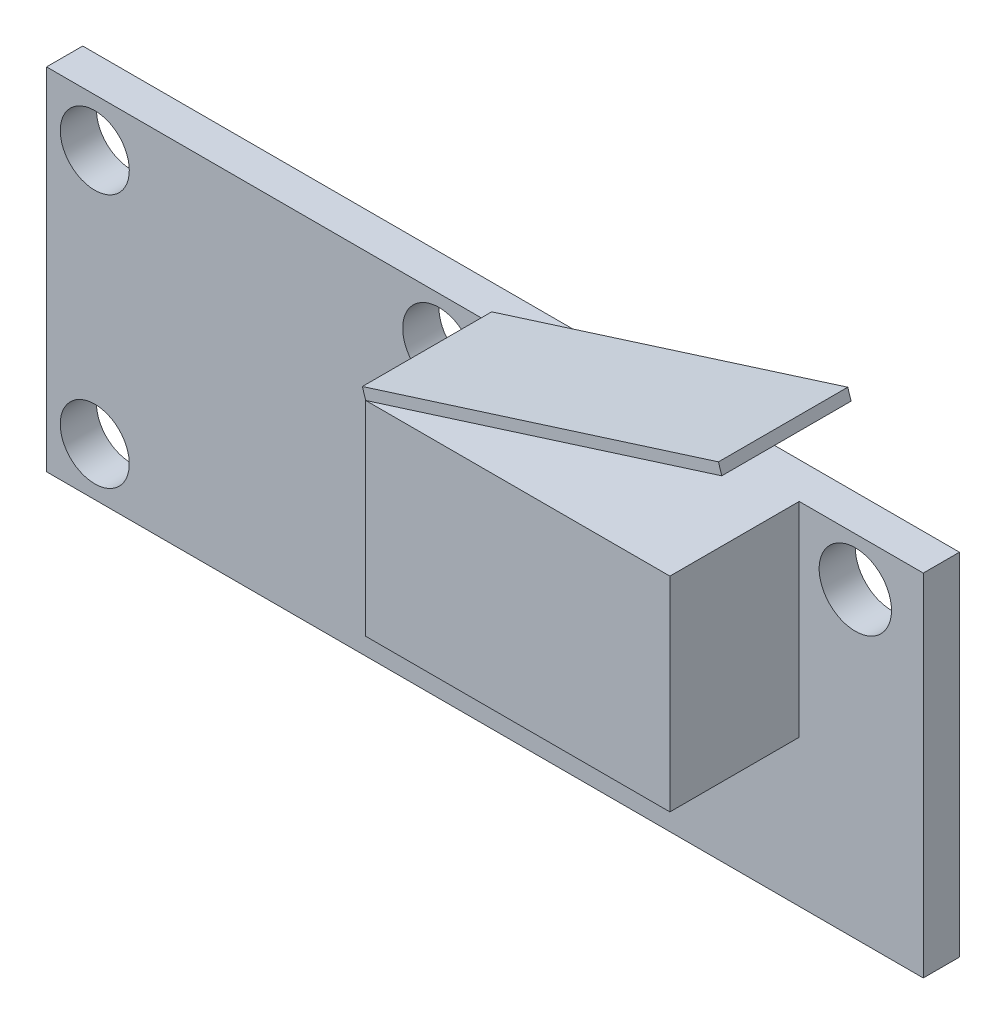
from build123d import *

# Parameters (mm, degrees)
SCHIZZO1_W                   = 40
SCHIZZO1_H                   = 16
SCHIZZO1_R                   = 1.65
SCHIZZO1_R_2                 = 1.575
ESTRUSIONE_ESTRUSIONE1_DEPTH = 1.65
SCHIZZO2_W                   = 13.879649546
SCHIZZO2_H                   = 9.317455402
ESTRUSIONE_ESTRUSIONE2_DEPTH = 5.9
ESTRUSIONE_SOTTILE1_DEPTH    = 5.9


with BuildPart() as part:
    # Schizzo1 → Estrusione-Estrusione1 (new body)
    with BuildSketch(Plane.XY):
        with Locations((20, 8)):
            Rectangle(SCHIZZO1_W, SCHIZZO1_H)
        with Locations((36.9, 13.8)):
            Circle(SCHIZZO1_R, mode=Mode.SUBTRACT)
        with Locations((17.9, 13.8)):
            Circle(SCHIZZO1_R, mode=Mode.SUBTRACT)
        with Locations((2.2, 13.8)):
            Circle(SCHIZZO1_R_2, mode=Mode.SUBTRACT)
        with Locations(Location((2.2, 2.2, 0), (0, 0, 180))):
            Circle(SCHIZZO1_R_2, mode=Mode.SUBTRACT)
    extrude(amount=ESTRUSIONE_ESTRUSIONE1_DEPTH)

    # Schizzo2 → Estrusione-Estrusione2 (add)
    with BuildSketch(Plane.XY.offset(1.65)):
        with Locations((27.4, 11.341272299)):
            Rectangle(SCHIZZO2_W, SCHIZZO2_H)
    extrude(amount=ESTRUSIONE_ESTRUSIONE2_DEPTH)


with BuildPart() as body_2:
    # Schizzo3 → Estrusione-Sottile1 (new body)
    with BuildSketch(Plane.XY.offset(1.65)):
        Polygon((20.460175227, 16), (36.706382379, 21.145046824), (36.555425472, 21.621714436), (20.30921832, 16.476667612), align=None)
    extrude(amount=ESTRUSIONE_SOTTILE1_DEPTH)


solid = Compound([part.part, body_2.part])
